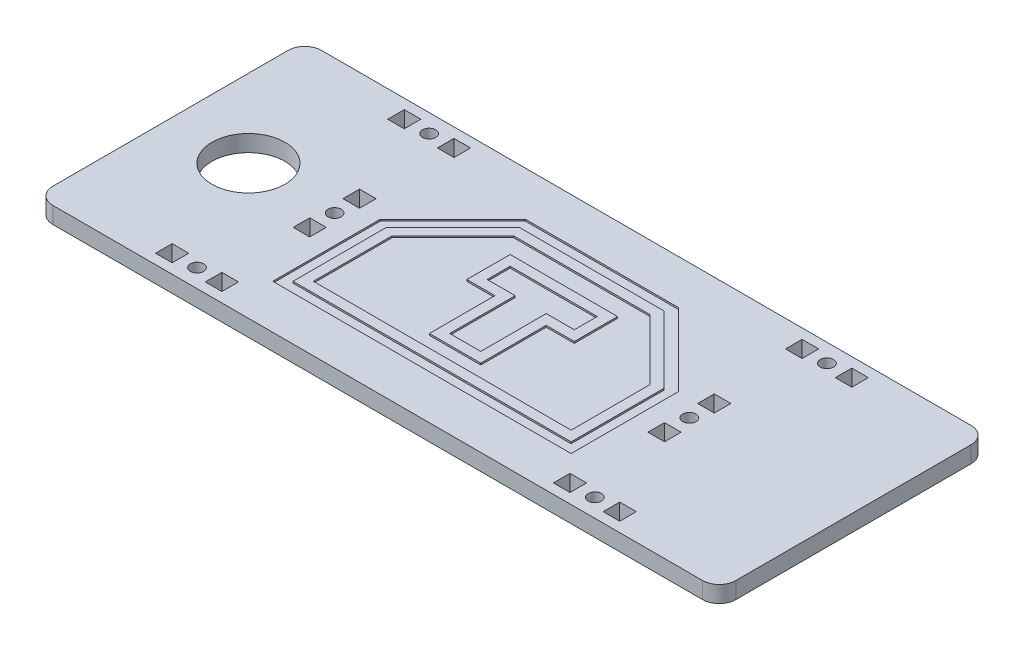
from build123d import *

# Parameters (mm, degrees)
SKETCH1_W           = 206
SKETCH1_H           = 81
SKETCH1_R           = 2
SKETCH1_R_2         = 11
SKETCH1_W_2         = 5
SKETCH1_H_2         = 5
BOSS_EXTRUDE1_DEPTH = 5
FILLET1_R           = 5
CUT_EXTRUDE1_DEPTH  = 0.5


with BuildPart() as part:
    # Sketch1 → Boss-Extrude1 (new body)
    with BuildSketch(Plane(origin=(0, 0, 0), x_dir=(1, 0, 0), z_dir=(0, 1, 0))):
        with Locations((5.102707087, 13.156325227)):
            Rectangle(SKETCH1_W, SKETCH1_H)
        with Locations(Location((-54.897292913, 48.156325227, 0), (0, 0, 270))):
            Circle(SKETCH1_R, mode=Mode.SUBTRACT)
        with Locations(Location((-54.897292913, -21.843674773, 0), (0, 0, 90))):
            Circle(SKETCH1_R, mode=Mode.SUBTRACT)
        with Locations(Location((65.102707087, -21.843674773, 0), (0, 0, 270))):
            Circle(SKETCH1_R, mode=Mode.SUBTRACT)
        with Locations(Location((65.102707087, 48.156325227, 0), (0, 0, 90))):
            Circle(SKETCH1_R, mode=Mode.SUBTRACT)
        with Locations(Location((-48.397292913, 13.156325227, 0), (0, 0, 270))):
            Circle(SKETCH1_R, mode=Mode.SUBTRACT)
        with Locations(Location((58.602707087, 13.156325227, 0), (0, 0, 90))):
            Circle(SKETCH1_R, mode=Mode.SUBTRACT)
        with Locations(Location((-74.397292913, 13.156325227, 0), (0, 0, 270))):
            Circle(SKETCH1_R_2, mode=Mode.SUBTRACT)
        with Locations((57.602707087, 48.156325227)):
            Rectangle(SKETCH1_W_2, SKETCH1_H_2, mode=Mode.SUBTRACT)
        with Locations((-62.397292913, 48.156325227)):
            Rectangle(SKETCH1_W_2, SKETCH1_H_2, mode=Mode.SUBTRACT)
        with Locations((-47.397292913, 48.156325227)):
            Rectangle(SKETCH1_W_2, SKETCH1_H_2, mode=Mode.SUBTRACT)
        with Locations((72.602707087, 48.156325227)):
            Rectangle(SKETCH1_W_2, SKETCH1_H_2, mode=Mode.SUBTRACT)
        with Locations((72.602707087, -21.843674773)):
            Rectangle(SKETCH1_W_2, SKETCH1_H_2, mode=Mode.SUBTRACT)
        with Locations((57.602707087, -21.843674773)):
            Rectangle(SKETCH1_W_2, SKETCH1_H_2, mode=Mode.SUBTRACT)
        with Locations((-47.397292913, -21.843674773)):
            Rectangle(SKETCH1_W_2, SKETCH1_H_2, mode=Mode.SUBTRACT)
        with Locations((-62.397292913, -21.843674773)):
            Rectangle(SKETCH1_W_2, SKETCH1_H_2, mode=Mode.SUBTRACT)
        with Locations((-48.397292913, 20.656325227)):
            Rectangle(SKETCH1_W_2, SKETCH1_H_2, mode=Mode.SUBTRACT)
        with Locations((-48.397292913, 5.656325227)):
            Rectangle(SKETCH1_W_2, SKETCH1_H_2, mode=Mode.SUBTRACT)
        with Locations((58.602707087, 5.656325227)):
            Rectangle(SKETCH1_W_2, SKETCH1_H_2, mode=Mode.SUBTRACT)
        with Locations((58.602707087, 20.656325227)):
            Rectangle(SKETCH1_W_2, SKETCH1_H_2, mode=Mode.SUBTRACT)
    extrude(amount=BOSS_EXTRUDE1_DEPTH)

    # Fillet1
    fillet1_edges = [part.edges().sort_by_distance(p)[0] for p in [
        (-97.897292913, 2.5, -53.656325227),
        (108.102707087, 2.5, -53.656325227),
        (108.102707087, 2.5, 27.343674773),
        (-97.897292913, 2.5, 27.343674773),
    ]]
    fillet(fillet1_edges, radius=FILLET1_R)

    # Sketch2 → Cut-Extrude1 (cut)
    with BuildSketch(Plane(origin=(0, 5, 0), x_dir=(1, 0, 0), z_dir=(0, 1, 0))):
        Polygon((-39.897292913, 18.396325227), (-39.897292913, -14.003674773), (5.102707087, -14.003674773), (5.102707087, -10.943674773), (-36.837292913, -10.943674773), (-36.837292913, 17.128831726), (-16.714799412, 37.251325227), (5.102707087, 37.251325227), (5.102707087, 40.311325227), (-17.982292913, 40.311325227), align=None)
        Polygon((5.102707087, -10.943674773), (5.102707087, -14.003674773), (50.102707087, -14.003674773), (50.102707087, 18.396325227), (28.187707087, 40.311325227), (5.102707087, 40.311325227), (5.102707087, 37.251325227), (26.920213586, 37.251325227), (47.042707087, 17.128831726), (47.042707087, -10.943674773), align=None)
        Polygon((5.102707087, -4.013674773), (5.102707087, -7.883674773), (43.982707087, -7.883674773), (43.982707087, 15.861338225), (25.652720085, 34.191325227), (5.102707087, 34.191325227), (5.102707087, 28.791325227), (21.302707087, 28.791325227), (21.302707087, 15.741325227), (12.842707087, 15.741325227), (12.842707087, -4.013674773), align=None)
        Polygon((-33.777292913, -7.883674773), (5.102707087, -7.883674773), (5.102707087, -4.013674773), (-2.637292913, -4.013674773), (-2.637292913, 15.741325227), (-11.097292913, 15.741325227), (-11.097292913, 28.791325227), (5.102707087, 28.791325227), (5.102707087, 34.191325227), (-15.447305912, 34.191325227), (-33.777292913, 15.861338225), align=None)
        Polygon((0.422707087, -0.953674773), (5.102707087, -0.953674773), (5.102707087, 25.731325227), (-8.037292913, 25.731325227), (-8.037292913, 18.801325227), (0.422707087, 18.801325227), align=None)
        Polygon((5.102707087, 25.731325227), (5.102707087, -0.953674773), (9.782707087, -0.953674773), (9.782707087, 18.801325227), (18.242707087, 18.801325227), (18.242707087, 25.731325227), align=None)
    extrude(amount=-CUT_EXTRUDE1_DEPTH, mode=Mode.SUBTRACT)


solid = part.part
